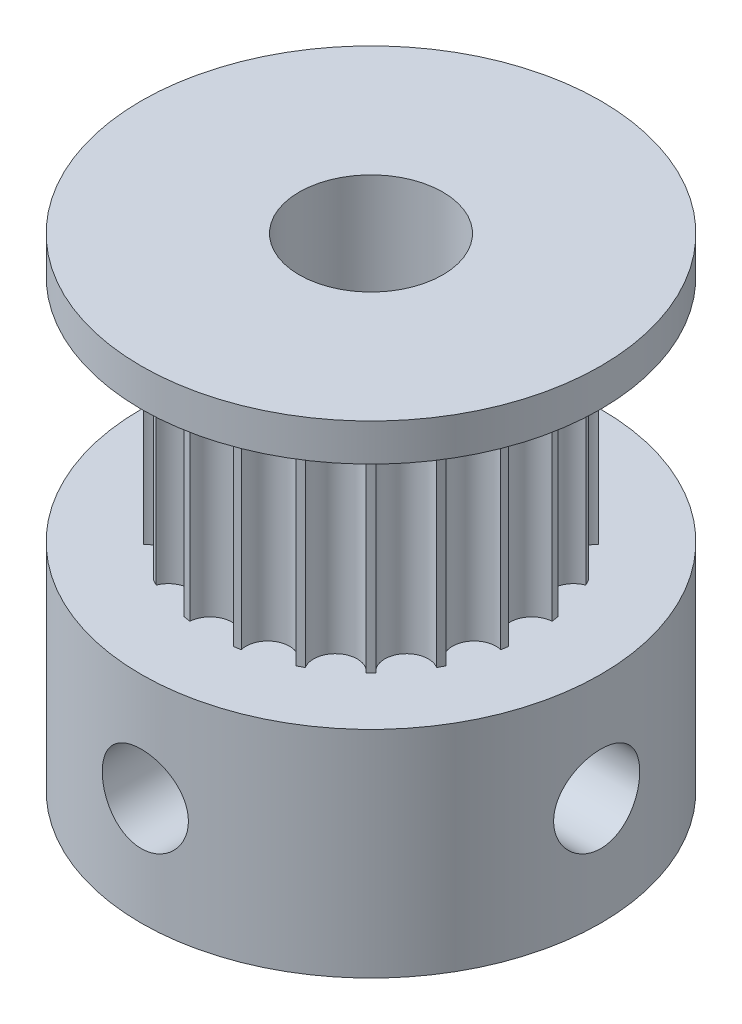
from build123d import *

# Parameters (mm, degrees)
BOSS_EXTRUDE1_DEPTH = 8
SKETCH2_R           = 8
BOSS_EXTRUDE2_DEPTH = 1.3
BOSS_EXTRUDE3_START = 7.5
SKETCH3_R           = 8
BOSS_EXTRUDE3_DEPTH = 7.5
SKETCH4_R           = 2.5
CUT_EXTRUDE1_DEPTH  = 18.5
SKETCH5_R           = 1.5
CUT_EXTRUDE2_DEPTH  = 10.5
SKETCH6_R           = 1.5
CUT_EXTRUDE3_DEPTH  = 16.5


with BuildPart() as part:
    # Sketch1 → Boss-Extrude1 (new body)
    with BuildSketch(Plane(origin=(0, 0, 0), x_dir=(1, 0, 0), z_dir=(0, 1, 0))):
        with BuildLine():
            ThreePointArc((-2.435695647, 5.042557557), (-2.542346799, 4.989636535), (-2.647848779, 4.934460137))
            ThreePointArc((-2.647848779, 4.934460137), (-2.844880621, 3.915642253), (-3.874720197, 4.043085876))
            ThreePointArc((-3.874720197, 4.043085876), (-3.959797975, 3.959797975), (-4.043085876, 3.874720197))
            ThreePointArc((-4.043085876, 3.874720197), (-3.915642253, 2.844880621), (-4.934460137, 2.647848779))
            ThreePointArc((-4.934460137, 2.647848779), (-4.989636535, 2.542346799), (-5.042557557, 2.435695647))
            ThreePointArc((-5.042557557, 2.435695647), (-4.603113539, 1.495642253), (-5.511180739, 0.993421795))
            ThreePointArc((-5.511180739, 0.993421795), (-5.531054707, 0.876033004), (-5.548428571, 0.758248236))
            ThreePointArc((-5.548428571, 0.758248236), (-4.84, 0), (-5.548428571, -0.758248236))
            ThreePointArc((-5.548428571, -0.758248236), (-5.531054707, -0.876033004), (-5.511180739, -0.993421795))
            ThreePointArc((-5.511180739, -0.993421795), (-4.603113539, -1.495642253), (-5.042557557, -2.435695647))
            ThreePointArc((-5.042557557, -2.435695647), (-4.989636535, -2.542346799), (-4.934460137, -2.647848779))
            ThreePointArc((-4.934460137, -2.647848779), (-3.915642253, -2.844880621), (-4.043085876, -3.874720197))
            ThreePointArc((-4.043085876, -3.874720197), (-3.959797975, -3.959797975), (-3.874720197, -4.043085876))
            ThreePointArc((-3.874720197, -4.043085876), (-2.844880621, -3.915642253), (-2.647848779, -4.934460137))
            ThreePointArc((-2.647848779, -4.934460137), (-2.542346799, -4.989636535), (-2.435695647, -5.042557557))
            ThreePointArc((-2.435695647, -5.042557557), (-1.495642253, -4.603113539), (-0.993421795, -5.511180739))
            ThreePointArc((-0.993421795, -5.511180739), (-0.876033004, -5.531054707), (-0.758248236, -5.548428571))
            ThreePointArc((-0.758248236, -5.548428571), (0, -4.84), (0.758248236, -5.548428571))
            ThreePointArc((0.758248236, -5.548428571), (0.876033004, -5.531054707), (0.993421795, -5.511180739))
            ThreePointArc((0.993421795, -5.511180739), (1.495642253, -4.603113539), (2.435695647, -5.042557557))
            ThreePointArc((2.435695647, -5.042557557), (2.542346799, -4.989636535), (2.647848779, -4.934460137))
            ThreePointArc((2.647848779, -4.934460137), (2.844880621, -3.915642253), (3.874720197, -4.043085876))
            ThreePointArc((3.874720197, -4.043085876), (3.959797975, -3.959797975), (4.043085876, -3.874720197))
            ThreePointArc((4.043085876, -3.874720197), (3.915642253, -2.844880621), (4.934460137, -2.647848779))
            ThreePointArc((4.934460137, -2.647848779), (4.989636535, -2.542346799), (5.042557557, -2.435695647))
            ThreePointArc((5.042557557, -2.435695647), (4.603113539, -1.495642253), (5.511180739, -0.993421795))
            ThreePointArc((5.511180739, -0.993421795), (5.531054707, -0.876033004), (5.548428571, -0.758248236))
            ThreePointArc((5.548428571, -0.758248236), (4.84, 0), (5.548428571, 0.758248236))
            ThreePointArc((5.548428571, 0.758248236), (5.531054707, 0.876033004), (5.511180739, 0.993421795))
            ThreePointArc((5.511180739, 0.993421795), (4.603113539, 1.495642253), (5.042557557, 2.435695647))
            ThreePointArc((5.042557557, 2.435695647), (4.989636535, 2.542346799), (4.934460137, 2.647848779))
            ThreePointArc((4.934460137, 2.647848779), (3.915642253, 2.844880621), (4.043085876, 3.874720197))
            ThreePointArc((4.043085876, 3.874720197), (3.959797975, 3.959797975), (3.874720197, 4.043085876))
            ThreePointArc((3.874720197, 4.043085876), (2.844880621, 3.915642253), (2.647848779, 4.934460137))
            ThreePointArc((2.647848779, 4.934460137), (2.542346799, 4.989636535), (2.435695647, 5.042557557))
            ThreePointArc((2.435695647, 5.042557557), (1.495642253, 4.603113539), (0.993421795, 5.511180739))
            ThreePointArc((0.993421795, 5.511180739), (0.876033004, 5.531054707), (0.758248236, 5.548428571))
            ThreePointArc((0.758248236, 5.548428571), (0, 4.84), (-0.758248236, 5.548428571))
            ThreePointArc((-0.758248236, 5.548428571), (-0.876033004, 5.531054707), (-0.993421795, 5.511180739))
            ThreePointArc((-0.993421795, 5.511180739), (-1.495642253, 4.603113539), (-2.435695647, 5.042557557))
        make_face()
    extrude(amount=BOSS_EXTRUDE1_DEPTH)

    # Sketch2 → Boss-Extrude2 (add)
    with BuildSketch(Plane(origin=(0, 8, 0), x_dir=(1, 0, 0), z_dir=(0, 1, 0))):
        with Locations(Location((0, 0, 0), (0, 0, 270))):
            Circle(SKETCH2_R)
    extrude(amount=BOSS_EXTRUDE2_DEPTH)

    # Sketch3 → Boss-Extrude3 (add)
    with BuildSketch(Plane.XZ.offset(BOSS_EXTRUDE3_START)):
        with Locations(Location((0, 0, 0), (0, 0, 90))):
            Circle(SKETCH3_R)
    extrude(amount=-BOSS_EXTRUDE3_DEPTH)

    # Sketch4 → Cut-Extrude1 (cut)
    with BuildSketch(Plane.XZ.offset(7.5)):
        with Locations(Location((0, 0, 0), (0, 0, 270))):
            Circle(SKETCH4_R)
    extrude(amount=-CUT_EXTRUDE1_DEPTH, mode=Mode.SUBTRACT)

    # Sketch5 → Cut-Extrude2 (cut)
    with BuildSketch(Plane(origin=(0, 0, 0), x_dir=(0, 0, -1), z_dir=(1, 0, 0))):
        with Locations(Location((0, -3.75, 0), (0, 0, 180))):
            Circle(SKETCH5_R)
    extrude(amount=CUT_EXTRUDE2_DEPTH, mode=Mode.SUBTRACT)

    # Sketch6 → Cut-Extrude3 (cut)
    with BuildSketch(Plane.XY):
        with Locations(Location((0, -3.75, 0), (0, 0, 180))):
            Circle(SKETCH6_R)
    extrude(amount=CUT_EXTRUDE3_DEPTH, mode=Mode.SUBTRACT)


solid = part.part
